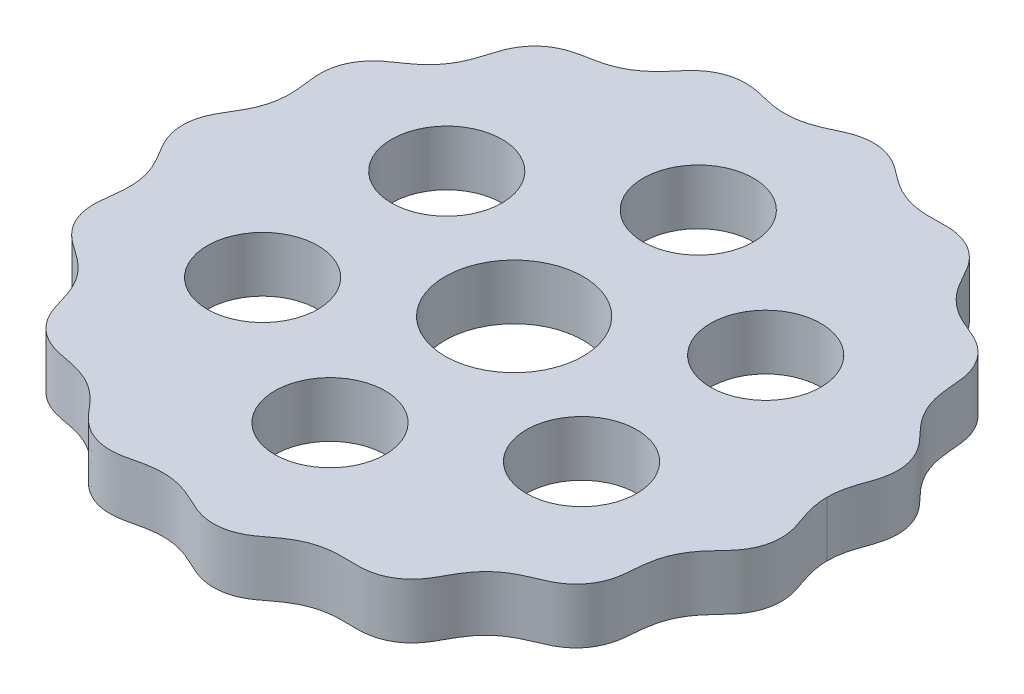
from build123d import *

# Parameters (mm, degrees)
BOSS_EXTRUDE1_DEPTH = 6
SKETCH4_R           = 7.5
SKETCH4_R_2         = 6
CUT_EXTRUDE1_DEPTH  = 52.384193919


with BuildPart() as part:
    # Sketch3 → Boss-Extrude1 (new body)
    with BuildSketch(Plane(origin=(0, 0, 0), x_dir=(1, 0, 0), z_dir=(0, 1, 0))):
        with BuildLine():
            add(Edge.make_bspline(
                [(35, 0), (35, -0.035819521), (35.000616373, -0.107462841), (35.003390054, -0.256808001), (35.01077535, -0.421646412), (35.021825769, -0.588219856), (35.036504882, -0.756672424), (35.059341773, -0.965837166), (35.104035951, -1.290553755), (35.185204177, -1.728353621), (35.321111932, -2.274340702), (35.511398877, -2.882930915), (35.744117036, -3.541888991), (35.999231194, -4.258009419), (36.256031973, -5.161379021), (36.390330129, -6.274752326), (36.277015947, -7.512136968), (35.868698722, -8.695231312), (35.277300884, -9.66942621), (34.554347706, -10.519941998), (33.783626013, -11.298902854), (32.985846748, -12.201646946), (32.264584631, -13.302976589), (31.737724515, -14.528623762), (31.426244596, -15.845428611), (31.299137645, -17.272582429), (31.216127, -18.70530298), (30.816120234, -20.100603953), (30.073240875, -21.341751417), (29.174351138, -22.250438514), (28.172415899, -22.896093054), (27.127590319, -23.355931745), (26.10859664, -23.758738205), (25.049780962, -24.277964858), (23.989709649, -24.997868071), (23.038745697, -25.922173331), (22.234852767, -27.032885429), (21.570018171, -28.281907031), (20.900127092, -29.513378935), (19.962466181, -30.574068753), (18.79518192, -31.366318649), (17.595631263, -31.810691731), (16.414666993, -31.97433085), (15.281171148, -31.958959306), (14.203514384, -31.91747762), (13.042151806, -31.968001953), (11.783279681, -32.201214224), (10.531309832, -32.66971044), (9.48395263, -33.292502605), (8.64833417, -33.920550222), (7.823957174, -34.560196787), (6.963270269, -35.155080008), (5.844676613, -35.655024643), (4.471519425, -35.893755086), (3.187084678, -35.805499476), (2.025952577, -35.461710054), (0.992256939, -34.976213141), (0.022683462, -34.502923006), (-1.053080375, -34.087641485), (-2.299584809, -33.794526859), (-3.643320491, -33.722351618), (-5.038534255, -33.89893647), (-6.24598376, -34.2125404), (-7.264354515, -34.444119371), (-8.305207807, -34.543324073), (-9.35208771, -34.482213909), (-10.516758731, -34.167289325), (-11.659268337, -33.537177777), (-12.590715473, -32.709121516), (-13.34098787, -31.814858509), (-14.054283468, -30.982389039), (-14.885038409, -30.182951686), (-15.921872801, -29.43179423), (-16.990420846, -28.917750141), (-18.026343297, -28.602305782), (-18.91800709, -28.413618025), (-19.578784746, -28.293993848), (-20.403759493, -28.135463838), (-21.377672688, -27.861653344), (-22.443971731, -27.335099918), (-23.483734656, -26.460176512), (-24.2541157, -25.405895772), (-24.750574375, -24.262578026), (-25.063904971, -23.146552345), (-25.378639074, -22.114017621), (-25.813131886, -21.064921211), (-26.460434486, -19.960662125), (-27.343829971, -18.932625358), (-28.322904319, -18.143559056), (-29.218225657, -17.541804862), (-30.028748291, -16.972737819), (-30.797058719, -16.328598531), (-31.549909645, -15.413617977), (-32.137977425, -14.188738612), (-32.4089126, -12.90202686), (-32.388985538, -11.637704019), (-32.213594685, -10.474436855), (-32.085323796, -9.385180269), (-32.070146732, -8.410557002), (-32.151917663, -7.56387468), (-32.314560623, -6.756019588), (-32.548800101, -5.992599911), (-32.857935391, -5.266485518), (-33.224571123, -4.579437291), (-33.588738685, -3.973485748), (-33.923596212, -3.433268023), (-34.247631958, -2.87530324), (-34.535248612, -2.28660009), (-34.721954293, -1.781365153), (-34.833464319, -1.375289499), (-34.894669525, -1.087159539), (-34.924762046, -0.921603411), (-34.949915122, -0.755248907), (-34.967564963, -0.608302523), (-34.979558938, -0.483828007), (-34.987456793, -0.380154151), (-34.992514334, -0.294893351), (-34.997257891, -0.183172559), (-34.999367206, -0.089514524), (-35, -0.035799586), (-35, 0)],
                knots=[0.072369566, 0.072369566, 0.072369566, 0.072369566, 0.072369566, 0.073615092, 0.074860618, 0.076106145, 0.077351671, 0.078597197, 0.079842723, 0.082333775, 0.087048504, 0.091763233, 0.096477961, 0.10119269, 0.107724794, 0.114256899, 0.124215283, 0.134174364, 0.144132897, 0.150929746, 0.157726596, 0.167142542, 0.176558488, 0.186520945, 0.196481925, 0.206428247, 0.21637457, 0.228908069, 0.238866866, 0.248825964, 0.258784129, 0.266347185, 0.273910241, 0.282559119, 0.291207998, 0.301173216, 0.311644672, 0.321600071, 0.33155547, 0.343058906, 0.353017844, 0.362977018, 0.372934936, 0.380512964, 0.388090993, 0.396475019, 0.404859045, 0.41482336, 0.425823506, 0.435780105, 0.440758404, 0.445736704, 0.456709828, 0.4666684, 0.476627191, 0.48658549, 0.494428383, 0.502271277, 0.510390705, 0.518510134, 0.528474739, 0.540002591, 0.549960093, 0.559917595, 0.565389224, 0.570860853, 0.580819423, 0.590778216, 0.600736338, 0.609094586, 0.617452834, 0.625307542, 0.633162249, 0.643125841, 0.655188139, 0.660154677, 0.665121215, 0.670087753, 0.675054292, 0.685012018, 0.694970449, 0.704929277, 0.714887192, 0.723259667, 0.731632143, 0.739222078, 0.746812013, 0.756777196, 0.769365725, 0.779035556, 0.783870472, 0.788705388, 0.798661668, 0.808620831, 0.818580086, 0.828537566, 0.837174689, 0.845811813, 0.853388632, 0.860965452, 0.865947313, 0.870929173, 0.87773944, 0.884549706, 0.889251298, 0.893952891, 0.898654484, 0.903356076, 0.908334949, 0.913313821, 0.914558654, 0.915803487, 0.91704832, 0.918293153, 0.919537985, 0.920160402, 0.920782818, 0.921405235, 0.922027651, 0.923272484, 0.923272484, 0.923272484, 0.923272484, 0.923272484], degree=4))
            add(Edge.make_bspline(
                [(35, 0), (35, 0.035819522), (35.000616373, 0.107462841), (35.003390054, 0.256808001), (35.01077535, 0.421646413), (35.021825769, 0.588219856), (35.036504882, 0.756672424), (35.059341773, 0.965837166), (35.104035951, 1.290553755), (35.185204177, 1.728353622), (35.321111932, 2.274340703), (35.511398877, 2.882930915), (35.744117036, 3.541888991), (35.999231193, 4.25800942), (36.256031973, 5.161379022), (36.390330129, 6.274752326), (36.277015947, 7.512136969), (35.868698722, 8.695231313), (35.277300884, 9.669426211), (34.554347705, 10.519941998), (33.783626013, 11.298902855), (32.985846748, 12.201646947), (32.264584631, 13.30297659), (31.737724515, 14.528623762), (31.426244596, 15.845428611), (31.299137645, 17.27258243), (31.216127, 18.70530298), (30.816120234, 20.100603953), (30.073240875, 21.341751418), (29.174351138, 22.250438515), (28.172415899, 22.896093055), (27.127590318, 23.355931746), (26.10859664, 23.758738206), (25.049780962, 24.277964858), (23.989709649, 24.997868072), (23.038745697, 25.922173331), (22.234852767, 27.03288543), (21.57001817, 28.281907032), (20.900127092, 29.513378936), (19.962466181, 30.574068753), (18.795181919, 31.366318649), (17.595631263, 31.810691732), (16.414666993, 31.974330851), (15.281171148, 31.958959306), (14.203514384, 31.91747762), (13.042151806, 31.968001953), (11.783279681, 32.201214224), (10.531309832, 32.66971044), (9.48395263, 33.292502605), (8.648334169, 33.920550223), (7.823957174, 34.560196788), (6.963270269, 35.155080008), (5.844676613, 35.655024643), (4.471519425, 35.893755086), (3.187084678, 35.805499477), (2.025952576, 35.461710054), (0.992256939, 34.976213141), (0.022683462, 34.502923006), (-1.053080375, 34.087641485), (-2.299584809, 33.794526859), (-3.643320491, 33.722351619), (-5.038534255, 33.89893647), (-6.24598376, 34.2125404), (-7.264354515, 34.444119372), (-8.305207807, 34.543324073), (-9.35208771, 34.482213909), (-10.516758731, 34.167289325), (-11.659268337, 33.537177777), (-12.590715473, 32.709121516), (-13.34098787, 31.814858509), (-14.054283468, 30.982389039), (-14.885038409, 30.182951686), (-15.921872801, 29.431794231), (-16.990420846, 28.917750141), (-18.026343297, 28.602305782), (-18.918007091, 28.413618025), (-19.578784746, 28.293993849), (-20.403759493, 28.135463838), (-21.377672688, 27.861653344), (-22.443971731, 27.335099919), (-23.483734656, 26.460176512), (-24.2541157, 25.405895772), (-24.750574375, 24.262578026), (-25.063904971, 23.146552345), (-25.378639074, 22.114017621), (-25.813131886, 21.064921211), (-26.460434486, 19.960662125), (-27.343829971, 18.932625358), (-28.322904319, 18.143559056), (-29.218225657, 17.541804862), (-30.028748291, 16.97273782), (-30.797058719, 16.328598531), (-31.549909645, 15.413617977), (-32.137977425, 14.188738612), (-32.4089126, 12.90202686), (-32.388985538, 11.637704019), (-32.213594686, 10.474436855), (-32.085323796, 9.385180269), (-32.070146733, 8.410557002), (-32.151917663, 7.56387468), (-32.314560623, 6.756019588), (-32.548800101, 5.992599911), (-32.857935391, 5.266485518), (-33.224571124, 4.579437291), (-33.588738685, 3.973485748), (-33.923596212, 3.433268023), (-34.247631958, 2.87530324), (-34.535248612, 2.28660009), (-34.721954293, 1.781365153), (-34.833464319, 1.375289499), (-34.894669525, 1.087159539), (-34.924762046, 0.921603412), (-34.949915122, 0.755248907), (-34.967564963, 0.608302523), (-34.979558938, 0.483828007), (-34.987456793, 0.380154151), (-34.992514334, 0.294893351), (-34.997257891, 0.183172559), (-34.999367206, 0.089514524), (-35, 0.035799586), (-35, 0)],
                knots=[0.072369566, 0.072369566, 0.072369566, 0.072369566, 0.072369566, 0.073615092, 0.074860618, 0.076106145, 0.077351671, 0.078597197, 0.079842723, 0.082333775, 0.087048504, 0.091763233, 0.096477961, 0.10119269, 0.107724794, 0.114256899, 0.124215283, 0.134174364, 0.144132897, 0.150929746, 0.157726596, 0.167142542, 0.176558488, 0.186520945, 0.196481925, 0.206428247, 0.21637457, 0.228908069, 0.238866866, 0.248825964, 0.258784129, 0.266347185, 0.273910241, 0.282559119, 0.291207998, 0.301173216, 0.311644672, 0.321600071, 0.33155547, 0.343058906, 0.353017844, 0.362977018, 0.372934936, 0.380512964, 0.388090993, 0.396475019, 0.404859045, 0.41482336, 0.425823506, 0.435780105, 0.440758404, 0.445736704, 0.456709828, 0.4666684, 0.476627191, 0.48658549, 0.494428383, 0.502271277, 0.510390705, 0.518510134, 0.528474739, 0.540002591, 0.549960093, 0.559917595, 0.565389224, 0.570860853, 0.580819423, 0.590778216, 0.600736338, 0.609094586, 0.617452834, 0.625307542, 0.633162249, 0.643125841, 0.655188139, 0.660154677, 0.665121215, 0.670087753, 0.675054292, 0.685012018, 0.694970449, 0.704929277, 0.714887192, 0.723259667, 0.731632143, 0.739222078, 0.746812013, 0.756777196, 0.769365725, 0.779035556, 0.783870472, 0.788705388, 0.798661668, 0.808620831, 0.818580086, 0.828537566, 0.837174689, 0.845811813, 0.853388632, 0.860965452, 0.865947313, 0.870929173, 0.87773944, 0.884549706, 0.889251298, 0.893952891, 0.898654484, 0.903356076, 0.908334949, 0.913313821, 0.914558654, 0.915803487, 0.91704832, 0.918293153, 0.919537985, 0.920160402, 0.920782818, 0.921405235, 0.922027651, 0.923272484, 0.923272484, 0.923272484, 0.923272484, 0.923272484], degree=4))
        make_face()
    extrude(amount=BOSS_EXTRUDE1_DEPTH)

    # Sketch4 → Cut-Extrude1 (cut, through all)
    with BuildSketch(Plane(origin=(0, 6, 0), x_dir=(1, 0, 0), z_dir=(0, 1, 0))):
        with Locations(Location((1, 0, 0), (0, 0, 270))):
            Circle(SKETCH4_R)
        with Locations(Location((1, 20, 0), (0, 0, 270))):
            Circle(SKETCH4_R_2)
        with Locations(Location((18.320508076, 10, 0), (0, 0, 270))):
            Circle(SKETCH4_R_2)
        with Locations(Location((18.320508076, -10, 0), (0, 0, 270))):
            Circle(SKETCH4_R_2)
        with Locations(Location((1, -20, 0), (0, 0, 270))):
            Circle(SKETCH4_R_2)
        with Locations(Location((-16.320508076, -10, 0), (0, 0, 270))):
            Circle(SKETCH4_R_2)
        with Locations(Location((-16.320508076, 10, 0), (0, 0, 270))):
            Circle(SKETCH4_R_2)
    extrude(amount=-CUT_EXTRUDE1_DEPTH, mode=Mode.SUBTRACT)


solid = part.part
